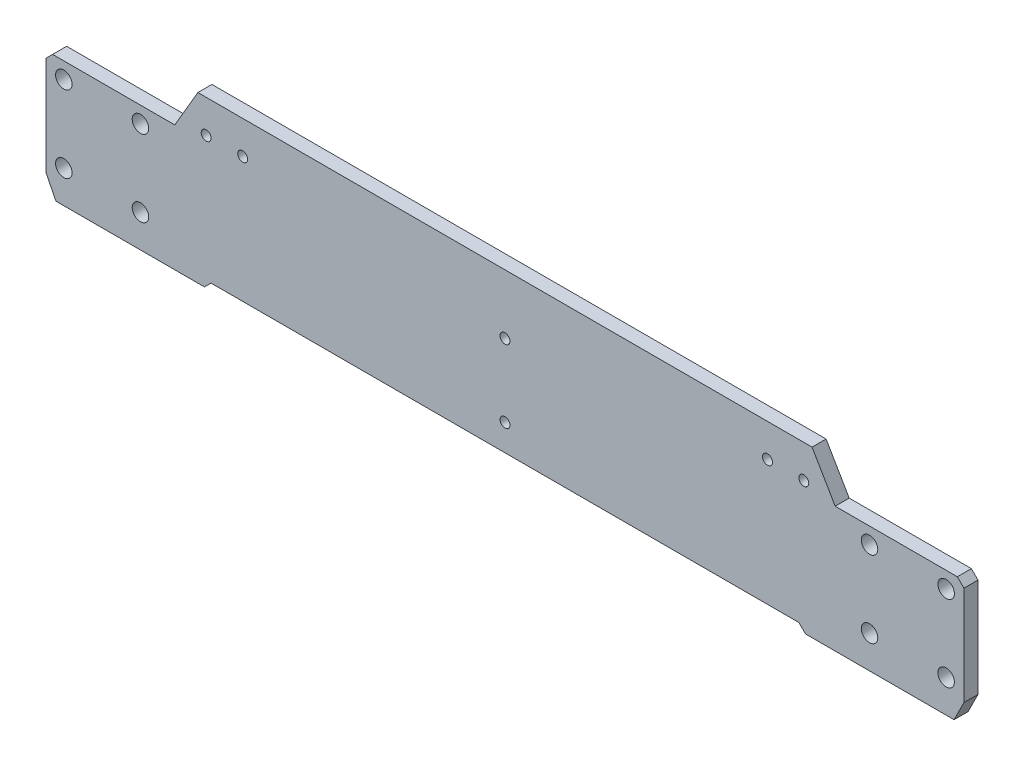
from build123d import *

# Parameters (mm, degrees)
SKETCH1_R           = 2.500025339
SKETCH1_R_2         = 2.500030275
SKETCH1_R_3         = 2.50059385
SKETCH1_R_4         = 2.49996671
SKETCH1_R_5         = 1.500006603
SKETCH1_R_6         = 1.500017827
SKETCH1_R_7         = 1.499993425
SKETCH1_R_8         = 1.500001567
SKETCH1_R_9         = 1.499994017
SKETCH1_R_10        = 2.500046291
SKETCH1_R_11        = 2.500203468
SKETCH1_R_12        = 2.500034464
SKETCH1_R_13        = 2.500151338
BOSS_EXTRUDE1_DEPTH = 4.25


with BuildPart() as part:
    # Sketch1 → Boss-Extrude1 (new body)
    with BuildSketch(Plane.XY):
        Polygon((-89, -1), (89, -1), (91, -3), (136, -3), (139, 3), (139, 33), (137, 35), (100, 35), (93, 47), (-93, 47), (-100, 35), (-137, 35), (-139, 33), (-139, 3), (-136, -3), (-91, -3), align=None)
        with Locations((-133.600349177, 30.099805675)):
            Circle(SKETCH1_R, mode=Mode.SUBTRACT)
        with Locations((-110.397163401, 30.086562155)):
            Circle(SKETCH1_R_2, mode=Mode.SUBTRACT)
        with Locations((-133.597969419, 6.885824912)):
            Circle(SKETCH1_R_3, mode=Mode.SUBTRACT)
        with Locations((-110.4, 6.899985)):
            Circle(SKETCH1_R_4, mode=Mode.SUBTRACT)
        with Locations((-90.5, 37)):
            Circle(SKETCH1_R_5, mode=Mode.SUBTRACT)
        with Locations((-79.435047391, 37.005403238)):
            Circle(SKETCH1_R_6, mode=Mode.SUBTRACT)
        with Locations((1.6217e-05, 29.00002115)):
            Circle(SKETCH1_R_7, mode=Mode.SUBTRACT)
        with Locations((0.007512826, 6.993184051)):
            Circle(SKETCH1_R_8, mode=Mode.SUBTRACT)
        with Locations((79.5, 37)):
            Circle(SKETCH1_R_5, mode=Mode.SUBTRACT)
        with Locations((90.500005983, 37.00001129)):
            Circle(SKETCH1_R_9, mode=Mode.SUBTRACT)
        with Locations((110.399953709, 30.100043687)):
            Circle(SKETCH1_R_10, mode=Mode.SUBTRACT)
        with Locations((133.599796532, 30.099959619)):
            Circle(SKETCH1_R_11, mode=Mode.SUBTRACT)
        with Locations((110.399965537, 6.899913257)):
            Circle(SKETCH1_R_12, mode=Mode.SUBTRACT)
        with Locations((133.599879489, 6.899786711)):
            Circle(SKETCH1_R_13, mode=Mode.SUBTRACT)
    extrude(amount=BOSS_EXTRUDE1_DEPTH)


solid = part.part
